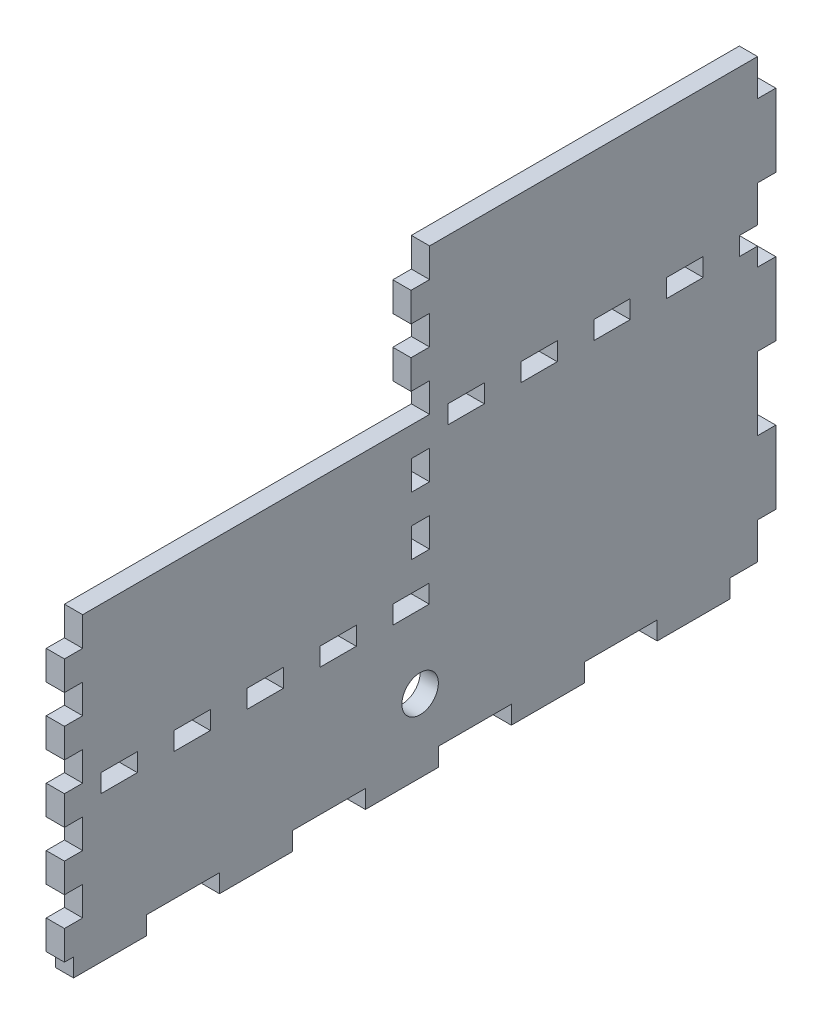
from build123d import *

# Parameters (mm, degrees)
BOSS_EXTRU_1_DEPTH         = 6.35
ESQUISSE4_W                = 6.35
ESQUISSE4_H                = 10.16
ESQUISSE4_W_2              = 6.472054313
ENL_V_MAT_EXTRU_1_DEPTH    = 237.318984637
R_P_TITION_LIN_AIRE3_COUNT = 3
R_P_TITION_LIN_AIRE3_PITCH = 20.32
ESQUISSE6_W                = 25.4
ESQUISSE6_H                = 6.35
BOSS_EXTRU_3_DEPTH         = 6.35
R_P_TITION_LIN_AIRE4_COUNT = 7
R_P_TITION_LIN_AIRE4_PITCH = 50.8
ESQUISSE7_W                = 6.35
ESQUISSE7_H                = 10.16
ENL_V_MAT_EXTRU_2_DEPTH    = 6.35
ESQUISSE8_W                = 12.7
ESQUISSE8_H                = 6.35
ENL_V_MAT_EXTRU_3_DEPTH    = 6.35
R_P_TITION_LIN_AIRE6_COUNT = 5
R_P_TITION_LIN_AIRE6_PITCH = 25.4
ESQUISSE9_W                = 6.35
ESQUISSE9_H                = 25.4
ENL_V_MAT_EXTRU_4_DEPTH    = 6.35
R_P_TITION_LIN_AIRE7_COUNT = 3
R_P_TITION_LIN_AIRE7_PITCH = 50.8
ESQUISSE10_W               = 6.35
ESQUISSE10_H               = 12.7
ENL_V_MAT_EXTRU_5_DEPTH    = 6.35
SKETCH1_W                  = 120.65
SKETCH1_H                  = 57.15
CUT_EXTRUDE1_DEPTH         = 237.318984637
ENL_V_MAT_EXTRU_6_REACH    = 238.319
ESQUISSE11_R               = 6.35


with BuildPart() as part:
    # Esquisse1 → Boss.-Extru.1 (new body)
    with BuildSketch(Plane(origin=(0, 0, 0), x_dir=(0, 0, -1), z_dir=(1, 0, 0))):
        Polygon((-57.15, 38.1), (-57.15, 88.9), (63.5, 88.9), (63.5, 139.7), (190.5, 139.7), (190.5, -12.7), (-177.8, -12.7), (-177.8, 38.1), align=None)
    extrude(amount=BOSS_EXTRU_1_DEPTH)

    # Esquisse4 → Enlèv. mat.-Extru.1 (cut, through all)
    with BuildSketch(Plane(origin=(6.35, 0, 0), x_dir=(0, 0, -1), z_dir=(1, 0, 0))):
        with Locations((-174.625, -7.62)):
            Rectangle(ESQUISSE4_W, ESQUISSE4_H)
        with Locations((-53.975, 43.18)):
            Rectangle(ESQUISSE4_W, ESQUISSE4_H)
        with Locations((66.736027157, 93.98)):
            Rectangle(ESQUISSE4_W_2, ESQUISSE4_H)
    enl_v_mat_extru_1 = extrude(amount=-ENL_V_MAT_EXTRU_1_DEPTH, mode=Mode.SUBTRACT)

    # Répétition linéaire3: Enlèv. mat.-Extru.1 ×3
    with Locations(*[(0, i * R_P_TITION_LIN_AIRE3_PITCH, 0) for i in range(1, R_P_TITION_LIN_AIRE3_COUNT)]):
        add(enl_v_mat_extru_1, mode=Mode.SUBTRACT)

    # Esquisse6 → Boss.-Extru.3 (add)
    with BuildSketch(Plane(origin=(6.35, 0, 0), x_dir=(0, 0, -1), z_dir=(1, 0, 0))):
        with Locations((-142.875, -15.875)):
            Rectangle(ESQUISSE6_W, ESQUISSE6_H)
    boss_extru_3 = extrude(amount=-BOSS_EXTRU_3_DEPTH)

    # Répétition linéaire4: Boss.-Extru.3 ×7
    with Locations(*[(0, 0, -i * R_P_TITION_LIN_AIRE4_PITCH) for i in range(1, R_P_TITION_LIN_AIRE4_COUNT)]):
        add(boss_extru_3)

    # Esquisse7 → Enlèv. mat.-Extru.2 (cut)
    with BuildSketch(Plane(origin=(6.35, 0, 0), x_dir=(0, 0, -1), z_dir=(1, 0, 0))):
        with Locations((-53.975, 22.86)):
            Rectangle(ESQUISSE7_W, ESQUISSE7_H)
        with Locations((66.797054313, 73.66)):
            Rectangle(ESQUISSE7_W, ESQUISSE7_H)
        with Locations((-53.975, 2.54)):
            Rectangle(ESQUISSE7_W, ESQUISSE7_H)
        with Locations((66.797054313, 53.34)):
            Rectangle(ESQUISSE7_W, ESQUISSE7_H)
    extrude(amount=-ENL_V_MAT_EXTRU_2_DEPTH, mode=Mode.SUBTRACT)

    # Esquisse8 → Enlèv. mat.-Extru.3 (cut)
    with BuildSketch(Plane(origin=(6.35, 0, 0), x_dir=(0, 0, -1), z_dir=(1, 0, 0))):
        with Locations((-38.1, 34.925)):
            Rectangle(ESQUISSE8_W, ESQUISSE8_H)
        with Locations((82.672054313, 85.725)):
            Rectangle(ESQUISSE8_W, ESQUISSE8_H)
    enl_v_mat_extru_3 = extrude(amount=-ENL_V_MAT_EXTRU_3_DEPTH, mode=Mode.SUBTRACT)

    # Répétition linéaire6: Enlèv. mat.-Extru.3 ×5
    with Locations(*[(0, 0, -i * R_P_TITION_LIN_AIRE6_PITCH) for i in range(1, R_P_TITION_LIN_AIRE6_COUNT)]):
        add(enl_v_mat_extru_3, mode=Mode.SUBTRACT)

    # Esquisse9 → Enlèv. mat.-Extru.4 (cut)
    with BuildSketch(Plane(origin=(6.35, 0, 0), x_dir=(0, 0, -1), z_dir=(1, 0, 0))):
        with Locations((187.325, 88.9)):
            Rectangle(ESQUISSE9_W, ESQUISSE9_H)
    enl_v_mat_extru_4 = extrude(amount=-ENL_V_MAT_EXTRU_4_DEPTH, mode=Mode.SUBTRACT)

    # Répétition linéaire7: Enlèv. mat.-Extru.4 ×3
    with Locations(*[(0, -i * R_P_TITION_LIN_AIRE7_PITCH, 0) for i in range(1, R_P_TITION_LIN_AIRE7_COUNT)]):
        add(enl_v_mat_extru_4, mode=Mode.SUBTRACT)

    # Esquisse10 → Enlèv. mat.-Extru.5 (cut)
    with BuildSketch(Plane(origin=(6.35, 0, 0), x_dir=(0, 0, -1), z_dir=(1, 0, 0))):
        with Locations((187.325, 133.35)):
            Rectangle(ESQUISSE10_W, ESQUISSE10_H)
    extrude(amount=-ENL_V_MAT_EXTRU_5_DEPTH, mode=Mode.SUBTRACT)

    # Sketch1 → Cut-Extrude1 (cut, through all)
    with BuildSketch(Plane(origin=(6.35, 0, 0), x_dir=(0, 0, -1), z_dir=(1, 0, 0))):
        with Locations((-117.475, 9.525)):
            Rectangle(SKETCH1_W, SKETCH1_H)
    extrude(amount=-CUT_EXTRUDE1_DEPTH, mode=Mode.SUBTRACT)

    # Esquisse11 → Enlèv. mat.-Extru.6 (cut, up to next)
    with BuildSketch(Plane.ZY, mode=Mode.PRIVATE) as enl_v_mat_extru_6_sk1:
        with Locations((-66.675, 6.35)):
            Circle(ESQUISSE11_R)
    enl_v_mat_extru_6_tool1 = extrude(enl_v_mat_extru_6_sk1.sketch, amount=-ENL_V_MAT_EXTRU_6_REACH, mode=Mode.PRIVATE) & part.part
    add(enl_v_mat_extru_6_tool1.solids().sort_by_distance((0, 6.35, -66.675))[0], mode=Mode.SUBTRACT)


solid = part.part
